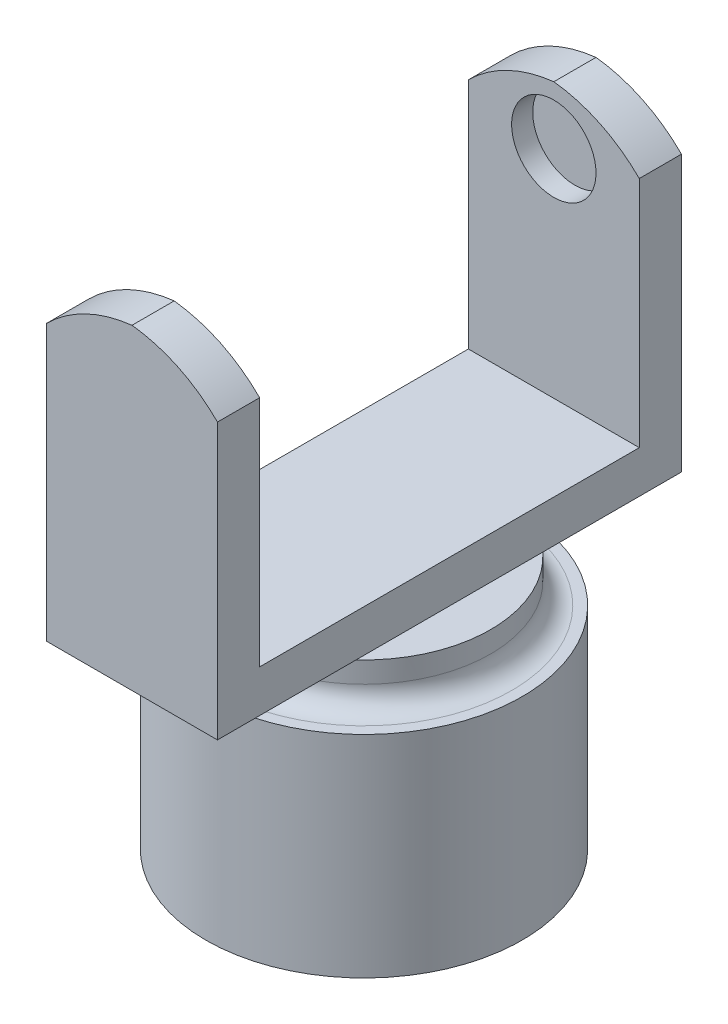
from build123d import *

# Parameters (mm, degrees)
SKETCH1_R                = 7.5
BOSS_EXTRUDE1_DEPTH      = 10
SKETCH5_R                = 6
BOSS_EXTRUDE2_DEPTH      = 2
FILLET2_R                = 1
BOSS_EXTRUDE3_DEPTH      = 6
BOSS_EXTRUDE3_DEPTH_BACK = 6
CUT_EXTRUDE4_DEPTH       = 29
CUT_EXTRUDE5_DEPTH       = 19
CUT_EXTRUDE5_DEPTH_BACK  = 1
SKETCH10_R               = 2
SKETCH12_R               = 5
CUT_EXTRUDE6_DEPTH       = 7
CUT_EXTRUDE7_START       = -36
CUT_EXTRUDE7_DEPTH       = 36


with BuildPart() as part:
    # Sketch1 → Boss-Extrude1 (new body)
    with BuildSketch(Plane(origin=(0, 0, 0), x_dir=(1, 0, 0), z_dir=(0, 1, 0))):
        Circle(SKETCH1_R)
    extrude(amount=BOSS_EXTRUDE1_DEPTH)

    # Sketch5 → Boss-Extrude2 (add)
    with BuildSketch(Plane(origin=(0, 10, 0), x_dir=(1, 0, 0), z_dir=(0, 1, 0))):
        Circle(SKETCH5_R)
    extrude(amount=BOSS_EXTRUDE2_DEPTH)

    # Fillet2
    fillet2_edges = [part.edges().sort_by_distance(p)[0] for p in [
        (-6, 10, 0),
    ]]
    fillet(fillet2_edges, radius=FILLET2_R)

    # Sketch6 → Boss-Extrude3 (add, two sides: drawn at the far end of the back side and taken through both)
    with BuildSketch(Plane(origin=(0, 0, 0), x_dir=(0, 0, -1), z_dir=(1, 0, 0)).offset(-BOSS_EXTRUDE3_DEPTH_BACK)):
        Polygon((6, 12), (-6, 12), (-11, 12), (-11, 27), (-9, 27), (-9, 14), (9, 14), (9, 27), (11, 27), (11, 12), align=None)
    extrude(amount=BOSS_EXTRUDE3_DEPTH + BOSS_EXTRUDE3_DEPTH_BACK)

    # Sketch9 → Cut-Extrude4 (cut)
    with BuildSketch(Plane.XY.offset(11)):
        with BuildLine():
            Line((-6, 27), (-6, 21))
            ThreePointArc((-6, 21), (-4.052343178, 25.052343178), (0, 27))
            Line((0, 27), (-6, 27))
        make_face()
        with BuildLine():
            ThreePointArc((0, 27), (4.052343178, 25.052343178), (6, 21))
            Line((6, 21), (6, 27))
            Line((6, 27), (0, 27))
        make_face()
    extrude(amount=-CUT_EXTRUDE4_DEPTH, mode=Mode.SUBTRACT)

    # Sketch10 → Cut-Extrude5 (cut, two sides: drawn at the far end of the back side and taken through both)
    with BuildSketch(Plane(origin=(0, 0, 9), x_dir=(-1, 0, 0), z_dir=(0, 0, -1)).offset(-CUT_EXTRUDE5_DEPTH_BACK)):
        with Locations((0, 24.25)):
            Circle(SKETCH10_R)
    extrude(amount=CUT_EXTRUDE5_DEPTH + CUT_EXTRUDE5_DEPTH_BACK, mode=Mode.SUBTRACT)

    # Sketch12 → Cut-Extrude6 (cut)
    with BuildSketch(Plane.XZ):
        Circle(SKETCH12_R)
    extrude(amount=-CUT_EXTRUDE6_DEPTH, mode=Mode.SUBTRACT)

    # Sketch13 → Cut-Extrude7 (cut)
    with BuildSketch(Plane(origin=(0, 0, -11), x_dir=(-1, 0, 0), z_dir=(0, 0, -1)).offset(CUT_EXTRUDE7_START)):
        with BuildLine():
            Line((-4.052343178, 12), (-4.052343178, 25.052343178))
            ThreePointArc((-4.052343178, 25.052343178), (-5.371235948, 23.192018094), (-6, 21))
            Line((-6, 21), (-6, 12))
            Line((-6, 12), (-4.052343178, 12))
        make_face()
        with BuildLine():
            Line((4.052343178, 25.052343178), (4.052343178, 12))
            Line((4.052343178, 12), (6, 12))
            Line((6, 12), (6, 21))
            ThreePointArc((6, 21), (5.371235948, 23.192018094), (4.052343178, 25.052343178))
        make_face()
    extrude(amount=CUT_EXTRUDE7_DEPTH, mode=Mode.SUBTRACT)


solid = part.part
